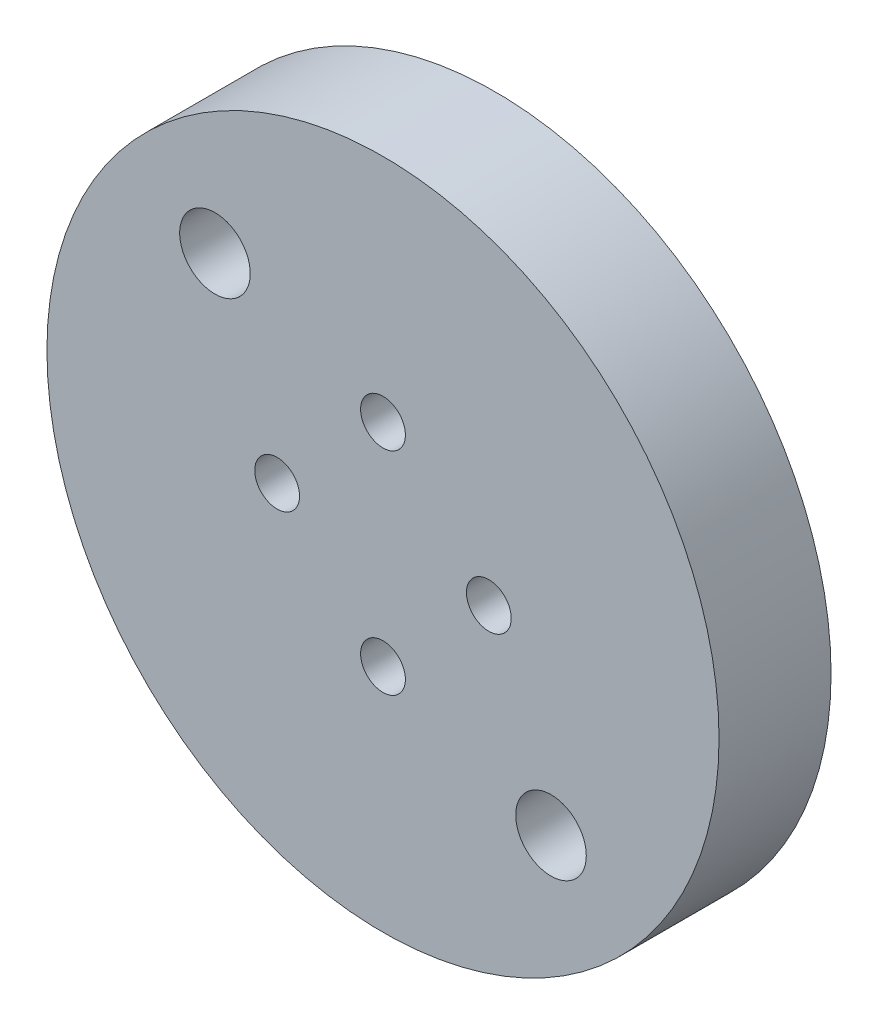
from build123d import *

# Parameters (mm, degrees)
SKETCH1_R           = 38.1
SKETCH1_R_2         = 2.54
BOSS_EXTRUDE1_DEPTH = 12.7
SKETCH2_R           = 4
CUT_EXTRUDE1_DEPTH  = 56.358016583
SKETCH3_R           = 9.525
CUT_EXTRUDE2_DEPTH  = 6.35
SKETCH4_R           = 4
CUT_EXTRUDE3_DEPTH  = 56.358016583
SKETCH5_R           = 9.525
CUT_EXTRUDE5_DEPTH  = 6.35


with BuildPart() as part:
    # Sketch1 → Boss-Extrude1 (new body)
    with BuildSketch(Plane.XY):
        Circle(SKETCH1_R)
        with Locations((12, 0)):
            Circle(SKETCH1_R_2, mode=Mode.SUBTRACT)
        with Locations((0, -12)):
            Circle(SKETCH1_R_2, mode=Mode.SUBTRACT)
        with Locations((-12, 0)):
            Circle(SKETCH1_R_2, mode=Mode.SUBTRACT)
        with Locations((0, 12)):
            Circle(SKETCH1_R_2, mode=Mode.SUBTRACT)
    extrude(amount=BOSS_EXTRUDE1_DEPTH)

    # Sketch2 → Cut-Extrude1 (cut, through all)
    with BuildSketch(Plane.XY):
        with Locations((19.05, -19.05)):
            Circle(SKETCH2_R)
    extrude(amount=CUT_EXTRUDE1_DEPTH, mode=Mode.SUBTRACT)

    # Sketch3 → Cut-Extrude2 (cut)
    with BuildSketch(Plane.XY):
        with Locations((19.05, -19.05)):
            Circle(SKETCH3_R)
    extrude(amount=CUT_EXTRUDE2_DEPTH, mode=Mode.SUBTRACT)

    # Sketch4 → Cut-Extrude3 (cut, through all)
    with BuildSketch(Plane.XY):
        with Locations((-19.05, 19.05)):
            Circle(SKETCH4_R)
    extrude(amount=CUT_EXTRUDE3_DEPTH, mode=Mode.SUBTRACT)

    # Sketch5 → Cut-Extrude5 (cut)
    with BuildSketch(Plane.XY):
        with Locations((-19.05, 19.05)):
            Circle(SKETCH5_R)
    extrude(amount=CUT_EXTRUDE5_DEPTH, mode=Mode.SUBTRACT)


solid = part.part
